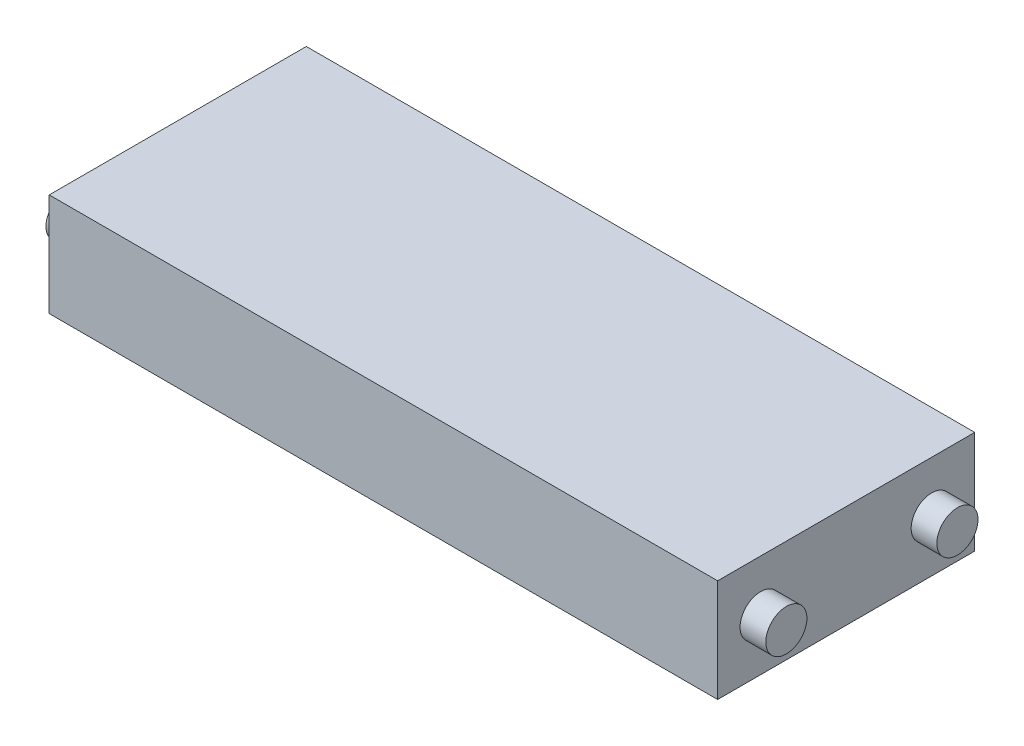
from build123d import *

# Parameters (mm, degrees)
SKETCH1_W                = 65
SKETCH1_H                = 25
BOSS_EXTRUDE1_DEPTH      = 10
BOSS_EXTRUDE2_DEPTH      = 2.5
BOSS_EXTRUDE2_DEPTH_BACK = 67.5
SKETCH2_R                = 2


with BuildPart() as part:
    # Sketch1 → Boss-Extrude1 (new body)
    with BuildSketch(Plane(origin=(0, 0, 0), x_dir=(1, 0, 0), z_dir=(0, 1, 0))):
        Rectangle(SKETCH1_W, SKETCH1_H)
    extrude(amount=BOSS_EXTRUDE1_DEPTH)

    # Sketch2 → Boss-Extrude2 (add, two sides: drawn at the far end of the back side and taken through both)
    with BuildSketch(Plane(origin=(32.5, 0, 0), x_dir=(0, 0, -1), z_dir=(1, 0, 0)).offset(-BOSS_EXTRUDE2_DEPTH_BACK)):
        with Locations((-8.319077052, 5)):
            Circle(SKETCH2_R)
        with Locations((8.319077052, 5)):
            Circle(SKETCH2_R)
    extrude(amount=BOSS_EXTRUDE2_DEPTH + BOSS_EXTRUDE2_DEPTH_BACK)


solid = part.part
